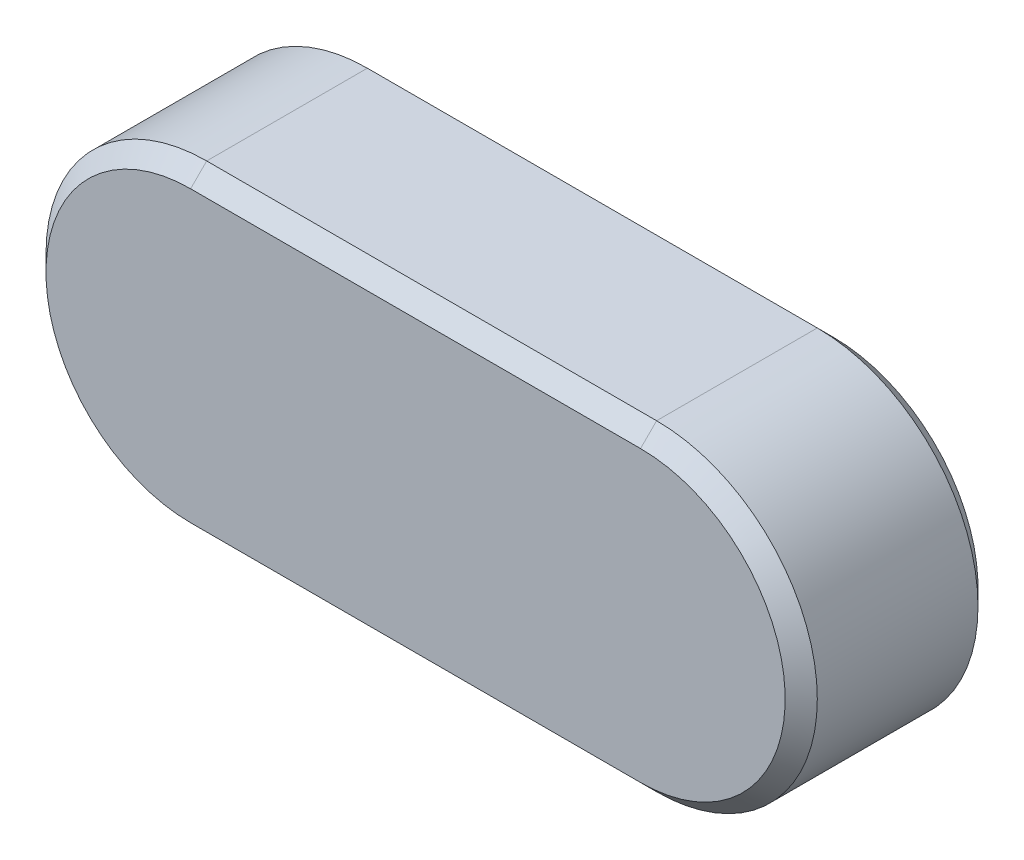
from build123d import *

# Parameters (mm, degrees)
EXTRUDE1_DEPTH = 3
CHAMFER1_SIZE  = 0.25


with BuildPart() as part:
    # Sketch1 → Extrude1 (new body)
    with BuildSketch(Plane.XY):
        with BuildLine():
            Line((0, 2.5), (-7, 2.5))
            ThreePointArc((-7, 2.5), (-9.5, 0), (-7, -2.5))
            Line((-7, -2.5), (0, -2.5))
            ThreePointArc((0, -2.5), (2.5, 0), (0, 2.5))
        make_face()
    extrude(amount=EXTRUDE1_DEPTH)

    # Chamfer1
    chamfer1_edges = [part.edges().sort_by_distance(p)[0] for p in [
        (-9.5, 0, 3),
        (-3.5, -2.5, 3),
        (2.5, 0, 3),
        (-3.5, -2.5, 0),
        (-9.5, 0, 0),
        (-3.5, 2.5, 0),
        (2.5, 0, 0),
        (-3.5, 2.5, 3),
    ]]
    chamfer(chamfer1_edges, length=CHAMFER1_SIZE)


solid = part.part
